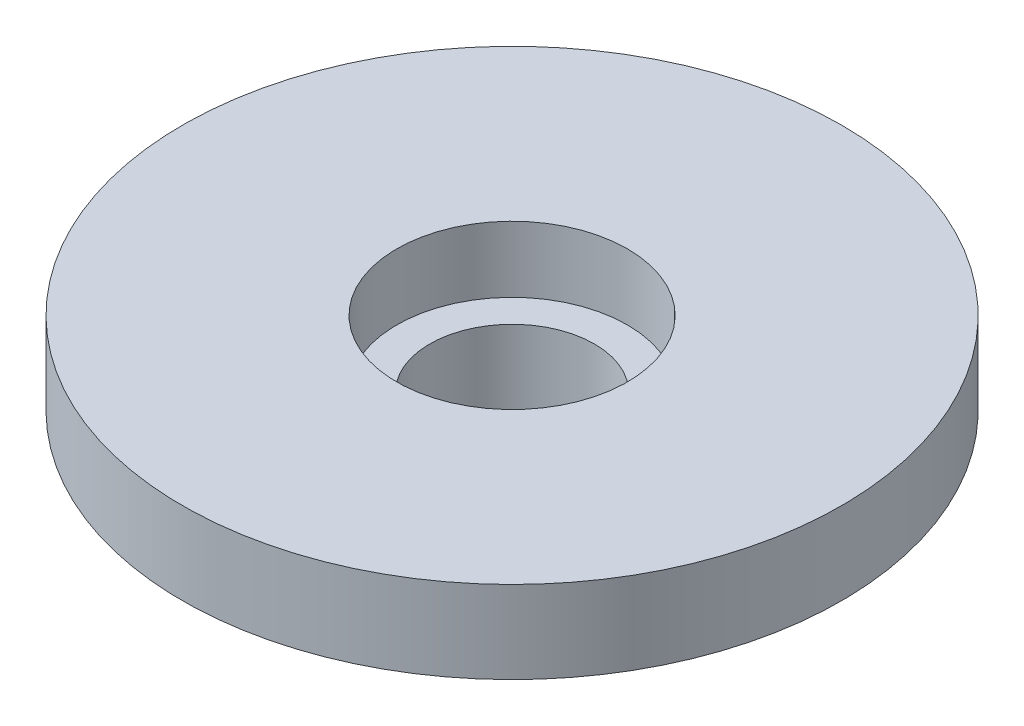
from build123d import *


with BuildPart() as part:
    # Sketch1 → Revolve1 (revolve)
    with BuildSketch(Plane.XY, mode=Mode.PRIVATE) as revolve1_sk:
        Polygon((2.5, 2.5), (3.5, 2.5), (3.5, 4.5), (10, 4.5), (10, 2), (5, 2), (5, 0), (2.5, 0), align=None)
    revolve(revolve1_sk.sketch.rotate(Axis((0, 0, 0), (0, 1, 0)), 90), axis=Axis((0, 0, 0), (0, 1, 0)))


solid = part.part
